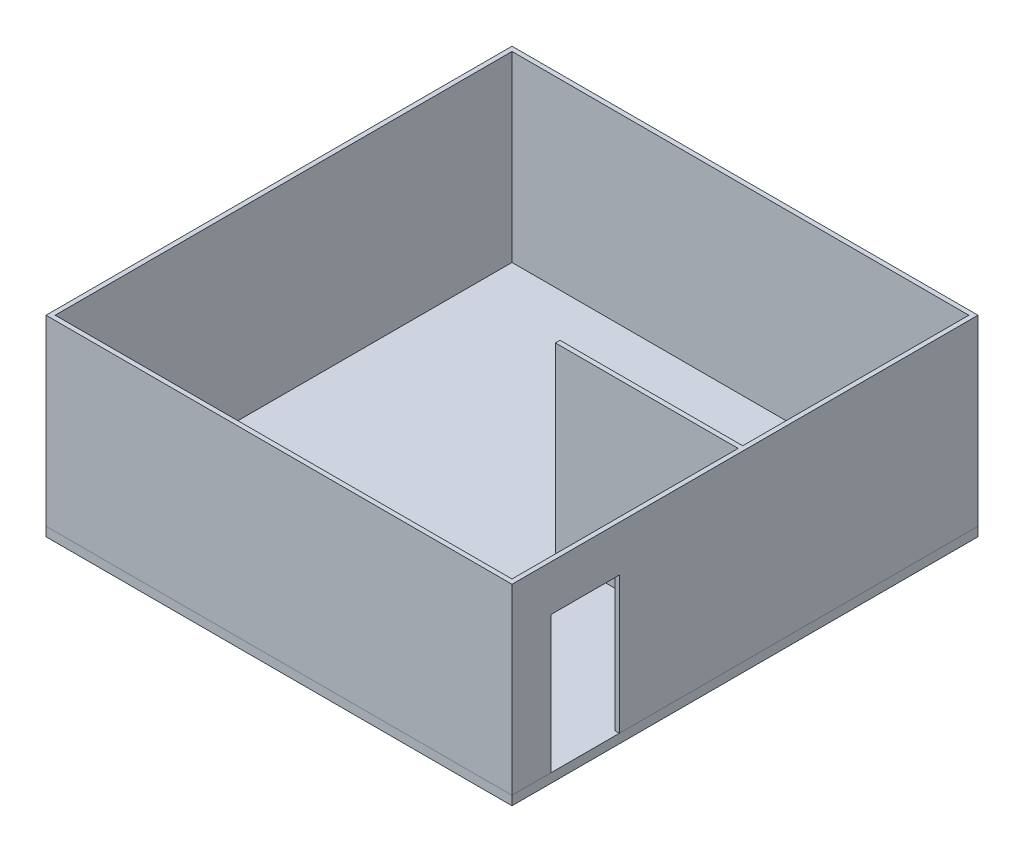
from build123d import *

# Parameters (mm, degrees)
SKETCH1_W           = 10200
SKETCH1_H           = 10200
SKETCH1_W_2         = 10000
SKETCH1_H_2         = 10000
SKETCH1_W_3         = 4000
SKETCH1_H_3         = 100
BOSS_EXTRUDE1_DEPTH = 4000
SKETCH2_W           = 10200
SKETCH2_H           = 10200
BOSS_EXTRUDE2_DEPTH = 200
SKETCH3_W           = 1500
SKETCH3_H           = 3000
CUT_EXTRUDE1_DEPTH  = 100


with BuildPart() as part:
    # Sketch1 → Boss-Extrude1 (new body)
    # profile 1 of 2: a face of its own
    with BuildSketch(Plane(origin=(0, 0, 0), x_dir=(1, 0, 0), z_dir=(0, 1, 0))):
        Rectangle(SKETCH1_W, SKETCH1_H)
        Rectangle(SKETCH1_W_2, SKETCH1_H_2, mode=Mode.SUBTRACT)
    # profile 2 of 2: a face of its own
    with BuildSketch(Plane(origin=(0, 0, 0), x_dir=(1, 0, 0), z_dir=(0, 1, 0))):
        with Locations((3000, 0)):
            Rectangle(SKETCH1_W_3, SKETCH1_H_3)
    extrude(amount=BOSS_EXTRUDE1_DEPTH)

    # Sketch3 → Cut-Extrude1 (cut)
    with BuildSketch(Plane(origin=(5100, 0, 0), x_dir=(0, 0, -1), z_dir=(1, 0, 0))):
        with Locations((-3500, 1500)):
            Rectangle(SKETCH3_W, SKETCH3_H)
    extrude(amount=-CUT_EXTRUDE1_DEPTH, mode=Mode.SUBTRACT)


with BuildPart() as body_2:
    # Sketch2 → Boss-Extrude2 (new body)
    with BuildSketch(Plane.XZ):
        Rectangle(SKETCH2_W, SKETCH2_H)
    extrude(amount=BOSS_EXTRUDE2_DEPTH)


solid = Compound([part.part, body_2.part])
